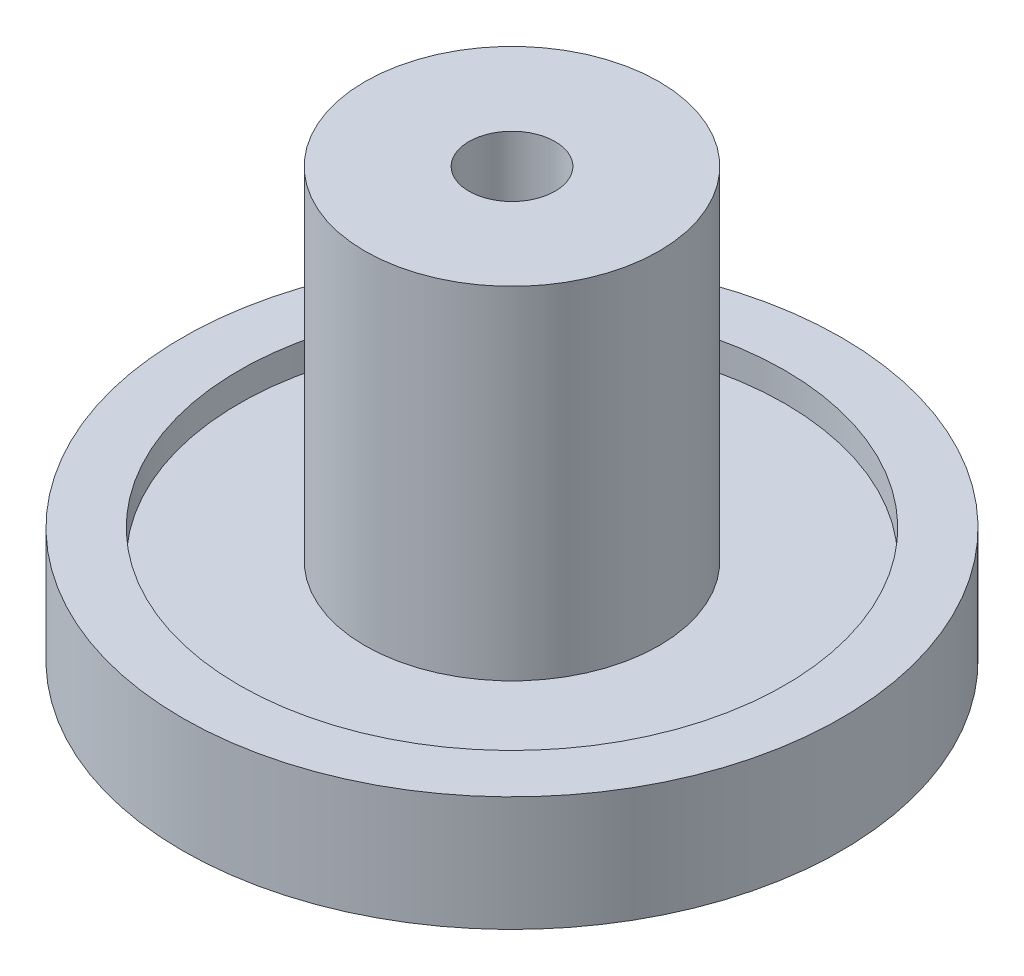
from build123d import *


with BuildPart() as part:
    # Sketch1 → 20 and 58 (revolve)
    with BuildSketch(Plane.XY, mode=Mode.PRIVATE) as f_20_and_58_sk:
        Polygon((1.5, 14.9), (1.5, 0), (3.5, 0), (3.5, 1.2), (9.5, 1.2), (9.5, 0), (11.477625, 0), (11.477625, 4), (9.5, 4), (9.5, 3), (5.1181, 3), (5.1181, 14.9), align=None)
    revolve(f_20_and_58_sk.sketch.rotate(Axis((0, 0, 0), (0, 1, 0)), 90), axis=Axis((0, 0, 0), (0, 1, 0)))


solid = part.part
